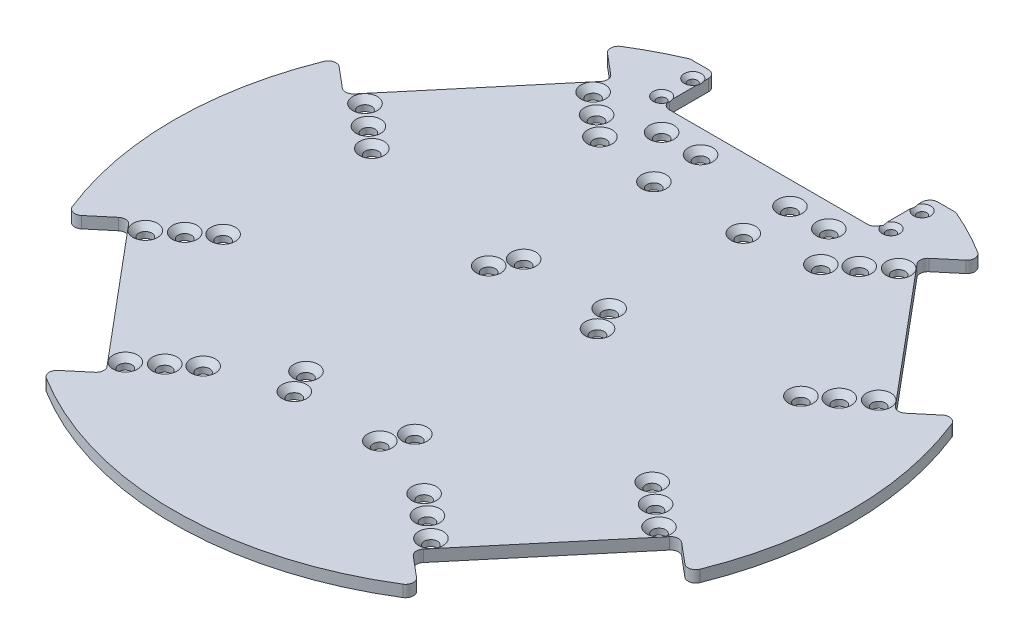
from build123d import *

# Parameters (mm, degrees)
ESBO_O1_R                                           = 87
RESSALTO_EXTRUS_O2_DEPTH                            = 3
CORTE_EXTRUS_O2_DEPTH                               = 3
FILETE1_R                                           = 2
ESCAREADO_PARA_PARAFUSO_COM_CABE_A_E_2_COUNT        = 2
ESCAREADO_PARA_PARAFUSO_COM_CABE_A_E_2_PITCH        = 7.2
ESCAREADO_PARA_PARAFUSO_COM_CABE_A_E_3_COUNT        = 2
ESCAREADO_PARA_PARAFUSO_COM_CABE_A_E_3_PITCH        = 14.2
ESCAREADO_PARA_PARAFUSO_COM_CABE_A_E_4_COUNT        = 2
ESCAREADO_PARA_PARAFUSO_COM_CABE_A_E_4_PITCH        = 41.65
ESCAREADO_PARA_PARAFUSO_COM_CABE_A_E_5_COUNT        = 2
ESCAREADO_PARA_PARAFUSO_COM_CABE_A_E_5_PITCH        = 42.267747752
ESCAREADO_PARA_PARAFUSO_COM_CABE_A_E_6_COUNT        = 2
ESCAREADO_PARA_PARAFUSO_COM_CABE_A_E_6_PITCH        = 44.004119125
ESCAREADO_PARA_PARAFUSO_COM_CABE_A_E_7_COUNT        = 2
ESCAREADO_PARA_PARAFUSO_COM_CABE_A_E_7_PITCH        = 56.514877462
ESCAREADO_PARA_PARAFUSO_COM_CABE_A_E_8_COUNT        = 2
ESCAREADO_PARA_PARAFUSO_COM_CABE_A_E_8_PITCH        = 52.179130573
ESCAREADO_PARA_PARAFUSO_COM_CABE_A_E_9_COUNT        = 2
ESCAREADO_PARA_PARAFUSO_COM_CABE_A_E_9_PITCH        = 48.619777719
ESCAREADO_PARA_PARAFUSO_COM_CABE_A_E_10_COUNT       = 2
ESCAREADO_PARA_PARAFUSO_COM_CABE_A_E_10_PITCH       = 92.384809882
ESCAREADO_PARA_PARAFUSO_COM_CABE_A_E_11_COUNT       = 2
ESCAREADO_PARA_PARAFUSO_COM_CABE_A_E_11_PITCH       = 89.798014398
ESCAREADO_PARA_PARAFUSO_COM_CABE_A_E_12_COUNT       = 2
ESCAREADO_PARA_PARAFUSO_COM_CABE_A_E_12_PITCH       = 87.777585453
ESCAREADO_PARA_PARAFUSO_COM_CABE_A_E_13_COUNT       = 2
ESCAREADO_PARA_PARAFUSO_COM_CABE_A_E_13_PITCH       = 137.558078571
ESCAREADO_PARA_PARAFUSO_COM_CABE_A_E_14_COUNT       = 2
ESCAREADO_PARA_PARAFUSO_COM_CABE_A_E_14_PITCH       = 130.358078571
ESCAREADO_PARA_PARAFUSO_COM_CABE_A_E_15_COUNT       = 2
ESCAREADO_PARA_PARAFUSO_COM_CABE_A_E_15_PITCH       = 123.358078571
ESCAREADO_PARA_PARAFUSO_COM_CABE_A_E_16_COUNT       = 2
ESCAREADO_PARA_PARAFUSO_COM_CABE_A_E_16_PITCH       = 143.725249974
ESCAREADO_PARA_PARAFUSO_COM_CABE_A_E_17_COUNT       = 2
ESCAREADO_PARA_PARAFUSO_COM_CABE_A_E_17_PITCH       = 136.850104672
ESCAREADO_PARA_PARAFUSO_COM_CABE_A_E_18_COUNT       = 2
ESCAREADO_PARA_PARAFUSO_COM_CABE_A_E_18_PITCH       = 130.199608481
ESCAREADO_PARA_PARAFUSO_COM_CABE_A_E_19_COUNT       = 2
ESCAREADO_PARA_PARAFUSO_COM_CABE_A_E_19_PITCH       = 132.147705639
ESCAREADO_PARA_PARAFUSO_COM_CABE_A_E_20_COUNT       = 2
ESCAREADO_PARA_PARAFUSO_COM_CABE_A_E_20_PITCH       = 126.716729287
ESCAREADO_PARA_PARAFUSO_COM_CABE_A_E_21_COUNT       = 2
ESCAREADO_PARA_PARAFUSO_COM_CABE_A_E_21_PITCH       = 121.612891024
ESCAREADO_PARA_PARAFUSO_COM_CABE_A_E_22_COUNT       = 2
ESCAREADO_PARA_PARAFUSO_COM_CABE_A_E_22_PITCH       = 97.204287666
ESCAREADO_PARA_PARAFUSO_COM_CABE_A_E_23_COUNT       = 2
ESCAREADO_PARA_PARAFUSO_COM_CABE_A_E_23_PITCH       = 103.518634838
ESCAREADO_PARA_PARAFUSO_COM_CABE_A_E_24_COUNT       = 2
ESCAREADO_PARA_PARAFUSO_COM_CABE_A_E_24_PITCH       = 110.099929078
ESBO_O5_W                                           = 68.38128399
ESBO_O5_H                                           = 7
CORTE_EXTRUS_O3_DEPTH                               = 3
FILETE2_R                                           = 2
ESCAREADO_PARA_PARAFUSO_COM_CABE_A_E_25_D           = 3.4
ESCAREADO_PARA_PARAFUSO_COM_CABE_A_E_25_DEPTH       = 7.25
ESCAREADO_PARA_PARAFUSO_COM_CABE_A_E_25_CSINK_D     = 6.3
ESCAREADO_PARA_PARAFUSO_COM_CABE_A_E_25_CSINK_ANGLE = 90
ESCAREADO_PARA_PARAFUSO_COM_CABE_A_E_25_TIP         = 1.021463052
ESCAREADO_PARA_PARAFUSO_COM_CABE_A_E_26_D           = 3.4
ESCAREADO_PARA_PARAFUSO_COM_CABE_A_E_26_DEPTH       = 7.25
ESCAREADO_PARA_PARAFUSO_COM_CABE_A_E_26_CSINK_D     = 6.3
ESCAREADO_PARA_PARAFUSO_COM_CABE_A_E_26_CSINK_ANGLE = 90
ESCAREADO_PARA_PARAFUSO_COM_CABE_A_E_26_TIP         = 1.021463052
ESCAREADO_PARA_PARAFUSO_COM_CABE_A_E_27_D           = 2.4
ESCAREADO_PARA_PARAFUSO_COM_CABE_A_E_27_DEPTH       = 10
ESCAREADO_PARA_PARAFUSO_COM_CABE_A_E_27_CSINK_D     = 4.4
ESCAREADO_PARA_PARAFUSO_COM_CABE_A_E_27_CSINK_ANGLE = 90
ESCAREADO_PARA_PARAFUSO_COM_CABE_A_E_27_TIP         = 0.721032743


with BuildPart() as part:
    # Esboço1 → Ressalto-extrusão2 (new body)
    with BuildSketch(Plane(origin=(0, 0, 0), x_dir=(1, 0, 0), z_dir=(0, 1, 0))):
        with Locations(Location((0, 0, 0), (0, 0, 270))):
            Circle(ESBO_O1_R)
    extrude(amount=RESSALTO_EXTRUS_O2_DEPTH)

    # Esboço2 → Corte-extrusão2 (cut)
    with BuildSketch(Plane(origin=(0, 3, 0), x_dir=(1, 0, 0), z_dir=(0, 1, 0))):
        Polygon((39.390846628, 65.035323466), (70.887439503, 27.499145753), (82.394162989, 37.154433186), (66.645866551, 55.922522043), (50.897570114, 74.690610899), align=None)
        Polygon((50.897570114, -74.690610899), (82.394162989, -37.154433186), (70.887439503, -27.499145753), (39.390846628, -65.035323466), align=None)
        Polygon((-39.390846628, -65.035323466), (-70.887439503, -27.499145753), (-82.394162989, -37.154433186), (-50.897570114, -74.690610899), align=None)
        Polygon((-66.645866551, 55.922522043), (-82.394162989, 37.154433186), (-70.887439503, 27.499145753), (-39.390846628, 65.035323466), (-50.897570114, 74.690610899), align=None)
    extrude(amount=-CORTE_EXTRUS_O2_DEPTH, mode=Mode.SUBTRACT)

    # Filete1
    filete1_edges = [part.edges().sort_by_distance(p)[0] for p in [
        (-48.200357724, 1.5, -72.427380978),
        (-79.696950599, 1.5, -34.891203265),
        (-70.887439503, 1.5, -27.499145753),
        (-39.390846628, 1.5, -65.035323466),
        (-48.200357724, 1.5, 72.427380978),
        (-39.390846628, 1.5, 65.035323466),
        (-79.696950599, 1.5, 34.891203265),
        (-70.887439503, 1.5, 27.499145753),
        (79.696950599, 1.5, 34.891203265),
        (70.887439503, 1.5, 27.499145753),
        (48.200357724, 1.5, 72.427380978),
        (39.390846628, 1.5, 65.035323466),
        (79.696950599, 1.5, -34.891203265),
        (48.200357724, 1.5, -72.427380978),
        (39.390846628, 1.5, -65.035323466),
        (70.887439503, 1.5, -27.499145753),
    ]]
    fillet(filete1_edges, radius=FILETE1_R)

    # Esboço4 → Escareado para parafuso com cabe_a escar (revolve, cut)
    with BuildSketch(Plane(origin=(-66.073852819, 3, 28.257438731), x_dir=(0, 0, 1), z_dir=(1, 0, 0))):
        Polygon((0, 0), (0, 3), (1.7, 3), (1.7, 1.45), (3.15, 0), align=None)
    escareado_para_parafuso_com_cabe_a_escar = revolve(axis=Axis((-66.073852819, 9.35, 28.257438731), (0, -1, 0)), mode=Mode.SUBTRACT)

    # Escareado para parafuso com cabe_a e 2: Escareado para parafuso com cabe_a escar ×2
    with Locations(*[Vector(0.766044443118978, 0, -0.6427876096865395) * (i * ESCAREADO_PARA_PARAFUSO_COM_CABE_A_E_2_PITCH) for i in range(1, ESCAREADO_PARA_PARAFUSO_COM_CABE_A_E_2_COUNT)]):
        add(escareado_para_parafuso_com_cabe_a_escar, mode=Mode.SUBTRACT)

    # Escareado para parafuso com cabe_a e 3: Escareado para parafuso com cabe_a escar ×2
    with Locations(*[Vector(0.7660444431189771, 0, -0.6427876096865404) * (i * ESCAREADO_PARA_PARAFUSO_COM_CABE_A_E_3_PITCH) for i in range(1, ESCAREADO_PARA_PARAFUSO_COM_CABE_A_E_3_COUNT)]):
        add(escareado_para_parafuso_com_cabe_a_escar, mode=Mode.SUBTRACT)

    # Escareado para parafuso com cabe_a e 4: Escareado para parafuso com cabe_a escar ×2
    with Locations(*[Vector(0.6427876096865409, 0, 0.7660444431189768) * (i * ESCAREADO_PARA_PARAFUSO_COM_CABE_A_E_4_PITCH) for i in range(1, ESCAREADO_PARA_PARAFUSO_COM_CABE_A_E_4_COUNT)]):
        add(escareado_para_parafuso_com_cabe_a_escar, mode=Mode.SUBTRACT)

    # Escareado para parafuso com cabe_a e 5: Escareado para parafuso com cabe_a escar ×2
    with Locations(*[Vector(0.7638832360689137, 0, 0.6453544775182738) * (i * ESCAREADO_PARA_PARAFUSO_COM_CABE_A_E_5_PITCH) for i in range(1, ESCAREADO_PARA_PARAFUSO_COM_CABE_A_E_5_COUNT)]):
        add(escareado_para_parafuso_com_cabe_a_escar, mode=Mode.SUBTRACT)

    # Escareado para parafuso com cabe_a e 6: Escareado para parafuso com cabe_a escar ×2
    with Locations(*[Vector(0.8556002434332315, 0, 0.517637154227742) * (i * ESCAREADO_PARA_PARAFUSO_COM_CABE_A_E_6_PITCH) for i in range(1, ESCAREADO_PARA_PARAFUSO_COM_CABE_A_E_6_COUNT)]):
        add(escareado_para_parafuso_com_cabe_a_escar, mode=Mode.SUBTRACT)

    # Escareado para parafuso com cabe_a e 7: Escareado para parafuso com cabe_a escar ×2
    with Locations(*[(0, 0, -i * ESCAREADO_PARA_PARAFUSO_COM_CABE_A_E_7_PITCH) for i in range(1, ESCAREADO_PARA_PARAFUSO_COM_CABE_A_E_7_COUNT)]):
        add(escareado_para_parafuso_com_cabe_a_escar, mode=Mode.SUBTRACT)

    # Escareado para parafuso com cabe_a e 8: Escareado para parafuso com cabe_a escar ×2
    with Locations(*[Vector(0.10570356251389786, 0, -0.9943976854718994) * (i * ESCAREADO_PARA_PARAFUSO_COM_CABE_A_E_8_PITCH) for i in range(1, ESCAREADO_PARA_PARAFUSO_COM_CABE_A_E_8_COUNT)]):
        add(escareado_para_parafuso_com_cabe_a_escar, mode=Mode.SUBTRACT)

    # Escareado para parafuso com cabe_a e 9: Escareado para parafuso com cabe_a escar ×2
    with Locations(*[Vector(0.22373263726514347, 0, -0.974650556364887) * (i * ESCAREADO_PARA_PARAFUSO_COM_CABE_A_E_9_PITCH) for i in range(1, ESCAREADO_PARA_PARAFUSO_COM_CABE_A_E_9_COUNT)]):
        add(escareado_para_parafuso_com_cabe_a_escar, mode=Mode.SUBTRACT)

    # Escareado para parafuso com cabe_a e 10: Escareado para parafuso com cabe_a escar ×2
    with Locations(*[Vector(0.2897890245978165, 0, -0.9570905501689201) * (i * ESCAREADO_PARA_PARAFUSO_COM_CABE_A_E_10_PITCH) for i in range(1, ESCAREADO_PARA_PARAFUSO_COM_CABE_A_E_10_COUNT)]):
        add(escareado_para_parafuso_com_cabe_a_escar, mode=Mode.SUBTRACT)

    # Escareado para parafuso com cabe_a e 11: Escareado para parafuso com cabe_a escar ×2
    with Locations(*[Vector(0.3595583282134979, 0, -0.9331226117784922) * (i * ESCAREADO_PARA_PARAFUSO_COM_CABE_A_E_11_PITCH) for i in range(1, ESCAREADO_PARA_PARAFUSO_COM_CABE_A_E_11_COUNT)]):
        add(escareado_para_parafuso_com_cabe_a_escar, mode=Mode.SUBTRACT)

    # Escareado para parafuso com cabe_a e 12: Escareado para parafuso com cabe_a escar ×2
    with Locations(*[Vector(0.4289242503256493, 0, -0.9033404604480969) * (i * ESCAREADO_PARA_PARAFUSO_COM_CABE_A_E_12_PITCH) for i in range(1, ESCAREADO_PARA_PARAFUSO_COM_CABE_A_E_12_COUNT)]):
        add(escareado_para_parafuso_com_cabe_a_escar, mode=Mode.SUBTRACT)

    # Escareado para parafuso com cabe_a e 13: Escareado para parafuso com cabe_a escar ×2
    with Locations(*[Vector(0.7660444431189767, 0, -0.642787609686541) * (i * ESCAREADO_PARA_PARAFUSO_COM_CABE_A_E_13_PITCH) for i in range(1, ESCAREADO_PARA_PARAFUSO_COM_CABE_A_E_13_COUNT)]):
        add(escareado_para_parafuso_com_cabe_a_escar, mode=Mode.SUBTRACT)

    # Escareado para parafuso com cabe_a e 14: Escareado para parafuso com cabe_a escar ×2
    with Locations(*[Vector(0.7660444431189768, 0, -0.6427876096865409) * (i * ESCAREADO_PARA_PARAFUSO_COM_CABE_A_E_14_PITCH) for i in range(1, ESCAREADO_PARA_PARAFUSO_COM_CABE_A_E_14_COUNT)]):
        add(escareado_para_parafuso_com_cabe_a_escar, mode=Mode.SUBTRACT)

    # Escareado para parafuso com cabe_a e 15: Escareado para parafuso com cabe_a escar ×2
    with Locations(*[Vector(0.7660444431189768, 0, -0.642787609686541) * (i * ESCAREADO_PARA_PARAFUSO_COM_CABE_A_E_15_PITCH) for i in range(1, ESCAREADO_PARA_PARAFUSO_COM_CABE_A_E_15_COUNT)]):
        add(escareado_para_parafuso_com_cabe_a_escar, mode=Mode.SUBTRACT)

    # Escareado para parafuso com cabe_a e 16: Escareado para parafuso com cabe_a escar ×2
    with Locations(*[Vector(0.9194466919532102, 0, -0.3932146750266308) * (i * ESCAREADO_PARA_PARAFUSO_COM_CABE_A_E_16_PITCH) for i in range(1, ESCAREADO_PARA_PARAFUSO_COM_CABE_A_E_16_COUNT)]):
        add(escareado_para_parafuso_com_cabe_a_escar, mode=Mode.SUBTRACT)

    # Escareado para parafuso com cabe_a e 17: Escareado para parafuso com cabe_a escar ×2
    with Locations(*[Vector(0.9253349564622245, 0, -0.3791506538950619) * (i * ESCAREADO_PARA_PARAFUSO_COM_CABE_A_E_17_PITCH) for i in range(1, ESCAREADO_PARA_PARAFUSO_COM_CABE_A_E_17_COUNT)]):
        add(escareado_para_parafuso_com_cabe_a_escar, mode=Mode.SUBTRACT)

    # Escareado para parafuso com cabe_a e 18: Escareado para parafuso com cabe_a escar ×2
    with Locations(*[Vector(0.9314150477179877, 0, -0.3639588010812473) * (i * ESCAREADO_PARA_PARAFUSO_COM_CABE_A_E_18_PITCH) for i in range(1, ESCAREADO_PARA_PARAFUSO_COM_CABE_A_E_18_COUNT)]):
        add(escareado_para_parafuso_com_cabe_a_escar, mode=Mode.SUBTRACT)

    # Escareado para parafuso com cabe_a e 19: Escareado para parafuso com cabe_a escar ×2
    with Locations(*[(i * ESCAREADO_PARA_PARAFUSO_COM_CABE_A_E_19_PITCH, 0, 0) for i in range(1, ESCAREADO_PARA_PARAFUSO_COM_CABE_A_E_19_COUNT)]):
        add(escareado_para_parafuso_com_cabe_a_escar, mode=Mode.SUBTRACT)

    # Escareado para parafuso com cabe_a e 20: Escareado para parafuso com cabe_a escar ×2
    with Locations(*[Vector(0.9993328139102698, 0, -0.036522965955436214) * (i * ESCAREADO_PARA_PARAFUSO_COM_CABE_A_E_20_PITCH) for i in range(1, ESCAREADO_PARA_PARAFUSO_COM_CABE_A_E_20_COUNT)]):
        add(escareado_para_parafuso_com_cabe_a_escar, mode=Mode.SUBTRACT)

    # Escareado para parafuso com cabe_a e 21: Escareado para parafuso com cabe_a escar ×2
    with Locations(*[Vector(0.9971794398212143, 0, -0.075054412247712) * (i * ESCAREADO_PARA_PARAFUSO_COM_CABE_A_E_21_PITCH) for i in range(1, ESCAREADO_PARA_PARAFUSO_COM_CABE_A_E_21_COUNT)]):
        add(escareado_para_parafuso_com_cabe_a_escar, mode=Mode.SUBTRACT)

    # Escareado para parafuso com cabe_a e 22: Escareado para parafuso com cabe_a escar ×2
    with Locations(*[Vector(0.9721564024753153, 0, 0.2343329450296156) * (i * ESCAREADO_PARA_PARAFUSO_COM_CABE_A_E_22_PITCH) for i in range(1, ESCAREADO_PARA_PARAFUSO_COM_CABE_A_E_22_COUNT)]):
        add(escareado_para_parafuso_com_cabe_a_escar, mode=Mode.SUBTRACT)

    # Escareado para parafuso com cabe_a e 23: Escareado para parafuso com cabe_a escar ×2
    with Locations(*[Vector(0.9646580237533655, 0, 0.26350502311768415) * (i * ESCAREADO_PARA_PARAFUSO_COM_CABE_A_E_23_PITCH) for i in range(1, ESCAREADO_PARA_PARAFUSO_COM_CABE_A_E_23_COUNT)]):
        add(escareado_para_parafuso_com_cabe_a_escar, mode=Mode.SUBTRACT)

    # Escareado para parafuso com cabe_a e 24: Escareado para parafuso com cabe_a escar ×2
    with Locations(*[Vector(0.9570905501689202, 0, 0.28978902459781636) * (i * ESCAREADO_PARA_PARAFUSO_COM_CABE_A_E_24_PITCH) for i in range(1, ESCAREADO_PARA_PARAFUSO_COM_CABE_A_E_24_COUNT)]):
        add(escareado_para_parafuso_com_cabe_a_escar, mode=Mode.SUBTRACT)

    # Esboço5 → Corte-extrusão3 (cut)
    with BuildSketch(Plane(origin=(0, 3, 0), x_dir=(1, 0, 0), z_dir=(0, 1, 0))):
        Polygon((27.5, 80), (-27.5, 80), (-27.5, 66), (0, 66), (27.5, 66), align=None)
        with Locations((0, 83.5)):
            Rectangle(ESBO_O5_W, ESBO_O5_H)
    extrude(amount=-CORTE_EXTRUS_O3_DEPTH, mode=Mode.SUBTRACT)

    # Filete2
    filete2_edges = [part.edges().sort_by_distance(p)[0] for p in [
        (-27.5, 1.5, -66),
        (-27.5, 1.5, -80),
        (-34.190641995, 1.5, -80),
        (34.190641995, 1.5, -80),
        (27.5, 1.5, -80),
        (27.5, 1.5, -66),
    ]]
    fillet(filete2_edges, radius=FILETE2_R)

    # Escareado para parafuso com cabe_a e 25
    with Locations(Plane(origin=(-21.5, 3, -60), x_dir=(0, 0, 1), z_dir=(0, 1, 0))):
        with Locations((0, 0), (0, 10), (12, 10), (12, 33), (0, 33), (0, 43)):
            CounterSinkHole(ESCAREADO_PARA_PARAFUSO_COM_CABE_A_E_25_D / 2, ESCAREADO_PARA_PARAFUSO_COM_CABE_A_E_25_CSINK_D / 2, depth=ESCAREADO_PARA_PARAFUSO_COM_CABE_A_E_25_DEPTH, counter_sink_angle=ESCAREADO_PARA_PARAFUSO_COM_CABE_A_E_25_CSINK_ANGLE)
            with Locations((0, 0, -(ESCAREADO_PARA_PARAFUSO_COM_CABE_A_E_25_DEPTH + ESCAREADO_PARA_PARAFUSO_COM_CABE_A_E_25_TIP / 2))):  # 118° drill point
                Cone(0, ESCAREADO_PARA_PARAFUSO_COM_CABE_A_E_25_D / 2, ESCAREADO_PARA_PARAFUSO_COM_CABE_A_E_25_TIP, mode=Mode.SUBTRACT)

    # Escareado para parafuso com cabe_a e 26
    with Locations(Plane(origin=(11, 3, -14), x_dir=(0, 0, 1), z_dir=(0, 1, 0))):
        with Locations((0, 0), (0, -22), (59, -22), (59, 0), (53, -25), (53, 3), (6, -25), (6, 3)):
            CounterSinkHole(ESCAREADO_PARA_PARAFUSO_COM_CABE_A_E_26_D / 2, ESCAREADO_PARA_PARAFUSO_COM_CABE_A_E_26_CSINK_D / 2, depth=ESCAREADO_PARA_PARAFUSO_COM_CABE_A_E_26_DEPTH, counter_sink_angle=ESCAREADO_PARA_PARAFUSO_COM_CABE_A_E_26_CSINK_ANGLE)
            with Locations((0, 0, -(ESCAREADO_PARA_PARAFUSO_COM_CABE_A_E_26_DEPTH + ESCAREADO_PARA_PARAFUSO_COM_CABE_A_E_26_TIP / 2))):  # 118° drill point
                Cone(0, ESCAREADO_PARA_PARAFUSO_COM_CABE_A_E_26_D / 2, ESCAREADO_PARA_PARAFUSO_COM_CABE_A_E_26_TIP, mode=Mode.SUBTRACT)

    # Escareado para parafuso com cabe_a e 27
    with Locations(Plane(origin=(-29.5, 3, -76), x_dir=(0, 0, 1), z_dir=(0, 1, 0))):
        with Locations((0, 0), (8, 0), (0, 59), (8, 59)):
            CounterSinkHole(ESCAREADO_PARA_PARAFUSO_COM_CABE_A_E_27_D / 2, ESCAREADO_PARA_PARAFUSO_COM_CABE_A_E_27_CSINK_D / 2, depth=ESCAREADO_PARA_PARAFUSO_COM_CABE_A_E_27_DEPTH, counter_sink_angle=ESCAREADO_PARA_PARAFUSO_COM_CABE_A_E_27_CSINK_ANGLE)
            with Locations((0, 0, -(ESCAREADO_PARA_PARAFUSO_COM_CABE_A_E_27_DEPTH + ESCAREADO_PARA_PARAFUSO_COM_CABE_A_E_27_TIP / 2))):  # 118° drill point
                Cone(0, ESCAREADO_PARA_PARAFUSO_COM_CABE_A_E_27_D / 2, ESCAREADO_PARA_PARAFUSO_COM_CABE_A_E_27_TIP, mode=Mode.SUBTRACT)


solid = part.part
